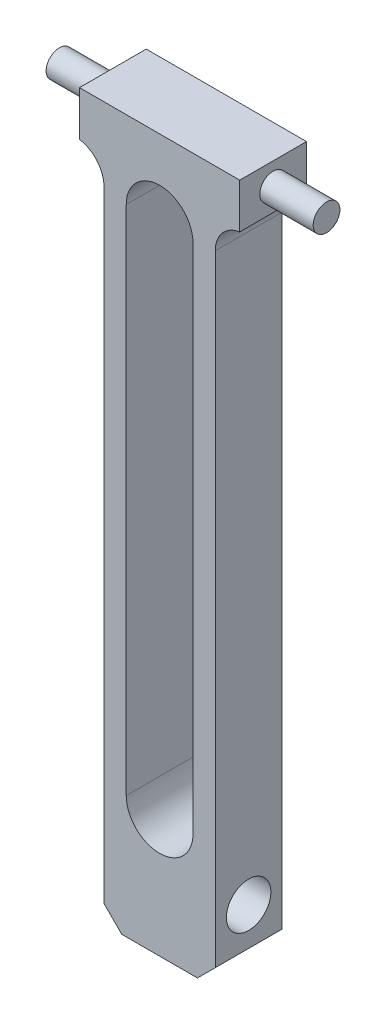
from build123d import *

# Parameters (mm, degrees)
AUFSATZ_LINEAR_AUSTRAGEN1_DEPTH = 7.5
SCHNITT_LINEAR_AUSTRAGEN1_DEPTH = 10
SKIZZE7_R                       = 2.5
SCHNITT_LINEAR_AUSTRAGEN4_DEPTH = 84.113251049
M4_GEWINDEBOHRUNG1_D            = 3.3
M4_GEWINDEBOHRUNG1_DEPTH        = 7.5
M4_GEWINDEBOHRUNG1_TIP          = 0.991420021
SKIZZE9_OUTSIDE_W               = 26.654
SKIZZE9_OUTSIDE_H               = 99.154
SKIZZE9_OUTSIDE_R               = 1.5
SCHNITT_LINEAR_AUSTRAGEN5_DEPTH = 6
SKIZZE10_OUTSIDE_W              = 26.654
SKIZZE10_OUTSIDE_H              = 99.154
SKIZZE10_OUTSIDE_R              = 1.5
SCHNITT_LINEAR_AUSTRAGEN6_DEPTH = 6


with BuildPart() as part:
    # Skizze1 → Aufsatz-Linear austragen1 (new body)
    with BuildSketch(Plane.XY):
        with BuildLine():
            Line((-8.75, 75), (-3.25, 75))
            ThreePointArc((-3.25, 75), (-0.951902961, 74.048097039), (0, 71.75))
            Line((0, 71.75), (0, 2))
            Line((0, 2), (2, 0))
            Line((2, 0), (10.5, 0))
            Line((10.5, 0), (12.5, 2))
            Line((12.5, 2), (12.5, 71.75))
            ThreePointArc((12.5, 71.75), (13.451902961, 74.048097039), (15.75, 75))
            Line((15.75, 75), (21.25, 75))
            Line((21.25, 75), (21.25, 80))
            Line((21.25, 80), (-8.75, 80))
            Line((-8.75, 80), (-8.75, 75))
        make_face()
    extrude(amount=AUFSATZ_LINEAR_AUSTRAGEN1_DEPTH)

    # Skizze2 → Schnitt-Linear austragen1 (cut)
    with BuildSketch(Plane.XY.offset(7.5)):
        with BuildLine():
            Line((10, 71.25), (10, 13.75))
            ThreePointArc((10, 13.75), (6.25, 10), (2.5, 13.75))
            Line((2.5, 13.75), (2.5, 71.25))
            ThreePointArc((2.5, 71.25), (6.25, 75), (10, 71.25))
        make_face()
    extrude(amount=-SCHNITT_LINEAR_AUSTRAGEN1_DEPTH, mode=Mode.SUBTRACT)

    # Skizze7 → Schnitt-Linear austragen4 (cut, through all)
    with BuildSketch(Plane(origin=(12.5, 0, 0), x_dir=(0, 0, -1), z_dir=(1, 0, 0))):
        with Locations(Location((-3.75, 6.25, 0), (0, 0, 90))):
            Circle(SKIZZE7_R)
    extrude(amount=-SCHNITT_LINEAR_AUSTRAGEN4_DEPTH, mode=Mode.SUBTRACT)

    # M4 Gewindebohrung1
    with Locations(Plane(origin=(6.25, 0, 3.75), x_dir=(0, 0, -1), z_dir=(0, -1, 0))):
        with Locations((0, 0)):
            Hole(M4_GEWINDEBOHRUNG1_D / 2, depth=M4_GEWINDEBOHRUNG1_DEPTH)
            with Locations((0, 0, -(M4_GEWINDEBOHRUNG1_DEPTH + M4_GEWINDEBOHRUNG1_TIP / 2))):  # 118° drill point
                Cone(0, M4_GEWINDEBOHRUNG1_D / 2, M4_GEWINDEBOHRUNG1_TIP, mode=Mode.SUBTRACT)

    # Skizze9 outside → Schnitt-Linear austragen5 (cut)
    with BuildSketch(Plane(origin=(21.25, 0, 0), x_dir=(0, 0, -1), z_dir=(1, 0, 0))):
        with Locations((-3.75, 40)):
            Rectangle(SKIZZE9_OUTSIDE_W, SKIZZE9_OUTSIDE_H)
        with Locations((-3.75, 77.5)):
            Circle(SKIZZE9_OUTSIDE_R, mode=Mode.SUBTRACT)
    extrude(amount=-SCHNITT_LINEAR_AUSTRAGEN5_DEPTH, mode=Mode.SUBTRACT)

    # Skizze10 outside → Schnitt-Linear austragen6 (cut)
    with BuildSketch(Plane.ZY.offset(8.75)):
        with Locations((3.75, 40)):
            Rectangle(SKIZZE10_OUTSIDE_W, SKIZZE10_OUTSIDE_H)
        with Locations(Location((3.75, 77.5, 0), (0, 0, 180))):
            Circle(SKIZZE10_OUTSIDE_R, mode=Mode.SUBTRACT)
    extrude(amount=-SCHNITT_LINEAR_AUSTRAGEN6_DEPTH, mode=Mode.SUBTRACT)


solid = part.part
